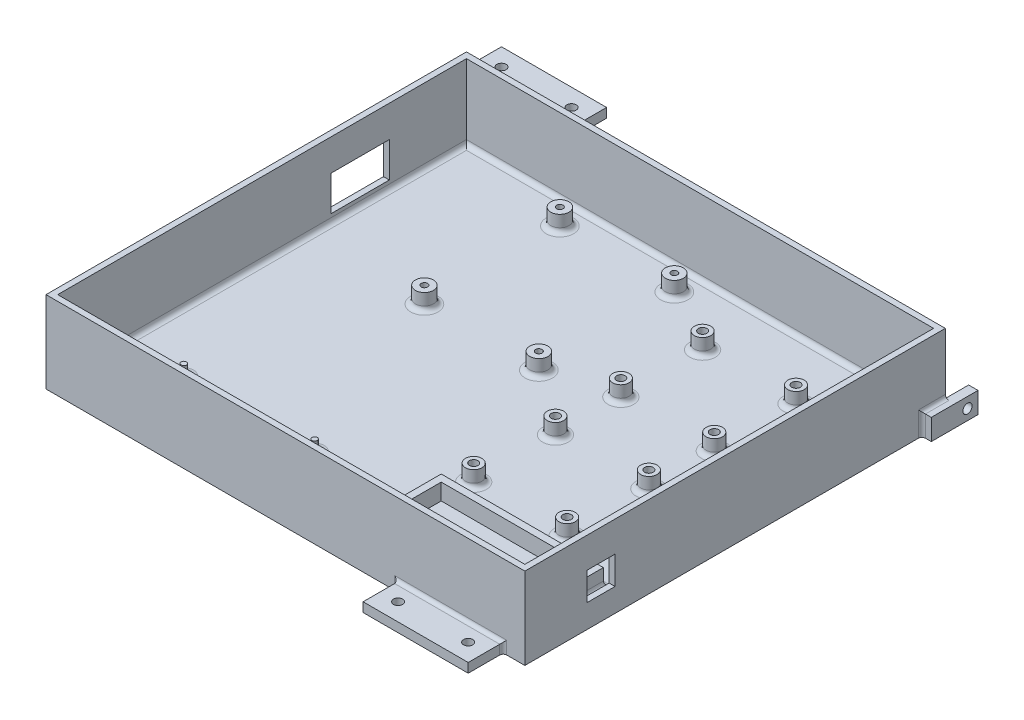
from build123d import *

# Parameters (mm, degrees)
SKETCH1_W           = 200
SKETCH1_H           = 175
BOSS_EXTRUDE1_DEPTH = 3
SKETCH2_W           = 69.4
SKETCH2_H           = 33.6
SKETCH2_W_2         = 63.4
SKETCH2_H_2         = 27.6
BOSS_EXTRUDE2_DEPTH = 7
SKETCH3_R           = 3.5
SKETCH3_R_2         = 1.818181818
BOSS_EXTRUDE3_DEPTH = 7
SKETCH4_R           = 3.863636364
SKETCH4_R_2         = 1.363636364
BOSS_EXTRUDE4_DEPTH = 7
SKETCH6_W           = 205
SKETCH6_H           = 180
SKETCH6_W_2         = 200
SKETCH6_H_2         = 175
BOSS_EXTRUDE5_DEPTH = 35
FILLET1_R           = 2
SKETCH7_W           = 12
SKETCH7_H           = 12
CUT_EXTRUDE1_DEPTH  = 225.346272534
SKETCH8_R           = 1.136363636
BOSS_EXTRUDE6_DEPTH = 4.5
FILLET2_R           = 3
SKETCH9_W           = 25
SKETCH9_H           = 15
CUT_EXTRUDE2_DEPTH  = 10
SKETCH10_W          = 20
SKETCH10_H          = 9
SKETCH10_R          = 1.98501
BOSS_EXTRUDE7_DEPTH = 4
SKETCH11_W          = 45
SKETCH11_H          = 15
SKETCH11_R          = 1.98501
BOSS_EXTRUDE8_DEPTH = 4
BOSS_EXTRUDE9_START = -25.4
SKETCH12_W          = 45
SKETCH12_H          = 15
SKETCH12_R          = 1.98501
BOSS_EXTRUDE9_DEPTH = 4
FILLET3_R           = 1.5


with BuildPart() as part:
    # Sketch1 → Boss-Extrude1 (new body)
    with BuildSketch(Plane(origin=(0, 0, 0), x_dir=(1, 0, 0), z_dir=(0, 1, 0))):
        Rectangle(SKETCH1_W, SKETCH1_H)
    extrude(amount=BOSS_EXTRUDE1_DEPTH)

    # Sketch2 → Boss-Extrude2 (add)
    with BuildSketch(Plane(origin=(0, 3, 0), x_dir=(1, 0, 0), z_dir=(0, 1, 0))):
        with Locations((58.3, -63.7)):
            Rectangle(SKETCH2_W, SKETCH2_H)
        with Locations((58.3, -63.7)):
            Rectangle(SKETCH2_W_2, SKETCH2_H_2, mode=Mode.SUBTRACT)
    extrude(amount=BOSS_EXTRUDE2_DEPTH)

    # Sketch3 → Boss-Extrude3 (add)
    # profile 1 of 8: a face of its own
    with BuildSketch(Plane(origin=(0, 3, 0), x_dir=(1, 0, 0), z_dir=(0, 1, 0))):
        with Locations(Location((26.5, -0.9, 0), (0, 0, 270))):
            Circle(SKETCH3_R)
        with Locations(Location((26.5, -0.9, 0), (0, 0, 270))):
            Circle(SKETCH3_R_2, mode=Mode.SUBTRACT)
    # profile 2 of 8: a face of its own
    with BuildSketch(Plane(origin=(0, 3, 0), x_dir=(1, 0, 0), z_dir=(0, 1, 0))):
        with Locations(Location((26.5, -35.9, 0), (0, 0, 270))):
            Circle(SKETCH3_R)
        with Locations(Location((26.5, -35.9, 0), (0, 0, 270))):
            Circle(SKETCH3_R_2, mode=Mode.SUBTRACT)
    # profile 3 of 8: a face of its own
    with BuildSketch(Plane(origin=(0, 3, 0), x_dir=(1, 0, 0), z_dir=(0, 1, 0))):
        with Locations(Location((66.5, -0.9, 0), (0, 0, 270))):
            Circle(SKETCH3_R)
        with Locations(Location((66.5, -0.9, 0), (0, 0, 270))):
            Circle(SKETCH3_R_2, mode=Mode.SUBTRACT)
    # profile 4 of 8: a face of its own
    with BuildSketch(Plane(origin=(0, 3, 0), x_dir=(1, 0, 0), z_dir=(0, 1, 0))):
        with Locations(Location((66.5, -35.9, 0), (0, 0, 270))):
            Circle(SKETCH3_R)
        with Locations(Location((66.5, -35.9, 0), (0, 0, 270))):
            Circle(SKETCH3_R_2, mode=Mode.SUBTRACT)
    # profile 5 of 8: a face of its own
    with BuildSketch(Plane(origin=(0, 3, 0), x_dir=(1, 0, 0), z_dir=(0, 1, 0))):
        with Locations(Location((66.5, 27.1, 0), (0, 0, 90))):
            Circle(SKETCH3_R)
        with Locations(Location((66.5, 27.1, 0), (0, 0, 90))):
            Circle(SKETCH3_R_2, mode=Mode.SUBTRACT)
    # profile 6 of 8: a face of its own
    with BuildSketch(Plane(origin=(0, 3, 0), x_dir=(1, 0, 0), z_dir=(0, 1, 0))):
        with Locations(Location((66.5, 62.1, 0), (0, 0, 90))):
            Circle(SKETCH3_R)
        with Locations(Location((66.5, 62.1, 0), (0, 0, 90))):
            Circle(SKETCH3_R_2, mode=Mode.SUBTRACT)
    # profile 7 of 8: a face of its own
    with BuildSketch(Plane(origin=(0, 3, 0), x_dir=(1, 0, 0), z_dir=(0, 1, 0))):
        with Locations(Location((26.5, 62.1, 0), (0, 0, 90))):
            Circle(SKETCH3_R)
        with Locations(Location((26.5, 62.1, 0), (0, 0, 90))):
            Circle(SKETCH3_R_2, mode=Mode.SUBTRACT)
    # profile 8 of 8: a face of its own
    with BuildSketch(Plane(origin=(0, 3, 0), x_dir=(1, 0, 0), z_dir=(0, 1, 0))):
        with Locations(Location((26.5, 27.1, 0), (0, 0, 90))):
            Circle(SKETCH3_R)
        with Locations(Location((26.5, 27.1, 0), (0, 0, 90))):
            Circle(SKETCH3_R_2, mode=Mode.SUBTRACT)
    extrude(amount=BOSS_EXTRUDE3_DEPTH)

    # Sketch4 → Boss-Extrude4 (add)
    # profile 1 of 4: a face of its own
    with BuildSketch(Plane(origin=(0, 3, 0), x_dir=(1, 0, 0), z_dir=(0, 1, 0))):
        with Locations(Location((-50, 77.5, 0), (0, 0, 270))):
            Circle(SKETCH4_R)
        with Locations(Location((-50, 77.5, 0), (0, 0, 270))):
            Circle(SKETCH4_R_2, mode=Mode.SUBTRACT)
    # profile 2 of 4: a face of its own
    with BuildSketch(Plane(origin=(0, 3, 0), x_dir=(1, 0, 0), z_dir=(0, 1, 0))):
        with Locations(Location((-1, 77.5, 0), (0, 0, 270))):
            Circle(SKETCH4_R)
        with Locations(Location((-1, 77.5, 0), (0, 0, 270))):
            Circle(SKETCH4_R_2, mode=Mode.SUBTRACT)
    # profile 3 of 4: a face of its own
    with BuildSketch(Plane(origin=(0, 3, 0), x_dir=(1, 0, 0), z_dir=(0, 1, 0))):
        with Locations(Location((-1, 19.5, 0), (0, 0, 270))):
            Circle(SKETCH4_R)
        with Locations(Location((-1, 19.5, 0), (0, 0, 270))):
            Circle(SKETCH4_R_2, mode=Mode.SUBTRACT)
    # profile 4 of 4: a face of its own
    with BuildSketch(Plane(origin=(0, 3, 0), x_dir=(1, 0, 0), z_dir=(0, 1, 0))):
        with Locations(Location((-50, 19.5, 0), (0, 0, 270))):
            Circle(SKETCH4_R)
        with Locations(Location((-50, 19.5, 0), (0, 0, 270))):
            Circle(SKETCH4_R_2, mode=Mode.SUBTRACT)
    extrude(amount=BOSS_EXTRUDE4_DEPTH)

    # Sketch6 → Boss-Extrude5 (add)
    with BuildSketch(Plane.XZ):
        Rectangle(SKETCH6_W, SKETCH6_H)
        Rectangle(SKETCH6_W_2, SKETCH6_H_2, mode=Mode.SUBTRACT)
    extrude(amount=-BOSS_EXTRUDE5_DEPTH)

    # Fillet1
    fillet1_edges = [part.edges().sort_by_distance(p)[0] for p in [
        (-50, 3, -81.363636364),
        (-1, 3, -81.363636364),
        (-1, 3, -23.363636364),
        (-50, 3, -23.363636364),
        (100, 3, 0),
        (0, 3, -87.5),
        (58.3, 3, 46.9),
        (23.6, 3, 63.7),
        (58.3, 3, 80.5),
        (93, 3, 63.7),
        (26.5, 3, 32.4),
        (26.5, 3, -2.6),
        (-100, 3, 0),
        (66.5, 3, -2.6),
        (66.5, 3, 32.4),
        (66.5, 3, -23.6),
        (66.5, 3, -58.6),
        (26.5, 3, -58.6),
        (26.5, 3, -23.6),
        (0, 3, 87.5),
    ]]
    fillet(fillet1_edges, radius=FILLET1_R)

    # Sketch7 → Cut-Extrude1 (cut, through all)
    with BuildSketch(Plane.ZY.offset(-100)):
        with Locations((57.4, 16)):
            Rectangle(SKETCH7_W, SKETCH7_H)
    extrude(amount=-CUT_EXTRUDE1_DEPTH, mode=Mode.SUBTRACT)

    # Sketch8 → Boss-Extrude6 (add)
    with BuildSketch(Plane(origin=(0, 3, 0), x_dir=(1, 0, 0), z_dir=(0, 1, 0))):
        with Locations(Location((-19, -58.5, 0), (0, 0, 270))):
            Circle(SKETCH8_R)
        with Locations(Location((-75, -58.5, 0), (0, 0, 270))):
            Circle(SKETCH8_R)
        with Locations(Location((-75, -77.5, 0), (0, 0, 270))):
            Circle(SKETCH8_R)
        with Locations(Location((-19, -77.5, 0), (0, 0, 270))):
            Circle(SKETCH8_R)
    extrude(amount=BOSS_EXTRUDE6_DEPTH)

    # Fillet2
    fillet2_edges = [part.edges().sort_by_distance(p)[0] for p in [
        (-19, 3, 57.363636364),
        (-75, 3, 57.363636364),
        (-75, 3, 76.363636364),
        (-19, 3, 76.363636364),
    ]]
    fillet(fillet2_edges, radius=FILLET2_R)

    # Sketch9 → Cut-Extrude2 (cut)
    with BuildSketch(Plane.ZY.offset(102.5)):
        with Locations((-42, 14)):
            Rectangle(SKETCH9_W, SKETCH9_H)
    extrude(amount=-CUT_EXTRUDE2_DEPTH, mode=Mode.SUBTRACT)

    # Sketch10 → Boss-Extrude7 (add)
    with BuildSketch(Plane(origin=(102.5, 0, 0), x_dir=(0, 0, -1), z_dir=(1, 0, 0))):
        with Locations((90, 4.5)):
            Rectangle(SKETCH10_W, SKETCH10_H)
        with Locations((95.5, 4.5)):
            Circle(SKETCH10_R, mode=Mode.SUBTRACT)
    extrude(amount=BOSS_EXTRUDE7_DEPTH)

    # Sketch11 → Boss-Extrude8 (add)
    with BuildSketch(Plane.XZ):
        with Locations((70.75, 97.5)):
            Rectangle(SKETCH11_W, SKETCH11_H)
        with Locations(Location((55.75, 97.5, 0), (0, 0, 270))):
            Circle(SKETCH11_R, mode=Mode.SUBTRACT)
        with Locations(Location((85.75, 97.5, 0), (0, 0, 270))):
            Circle(SKETCH11_R, mode=Mode.SUBTRACT)
    extrude(amount=-BOSS_EXTRUDE8_DEPTH)

    # Sketch12 → Boss-Extrude9 (add)
    with BuildSketch(Plane.XZ.offset(BOSS_EXTRUDE9_START)):
        with Locations((-80, -97.5)):
            Rectangle(SKETCH12_W, SKETCH12_H)
        with Locations(Location((-95, -97.5, 0), (0, 0, 270))):
            Circle(SKETCH12_R, mode=Mode.SUBTRACT)
        with Locations(Location((-65, -97.5, 0), (0, 0, 270))):
            Circle(SKETCH12_R, mode=Mode.SUBTRACT)
    extrude(amount=-BOSS_EXTRUDE9_DEPTH)

    # Fillet3
    fillet3_edges = [part.edges().sort_by_distance(p)[0] for p in [
        (102.5, 9, -85),
        (102.5, 4.5, -80),
        (48.25, 2, 90),
        (70.75, 4, 90),
        (93.25, 2, 90),
        (-80, 29.4, -90),
        (-57.5, 27.4, -90),
    ]]
    fillet(fillet3_edges, radius=FILLET3_R)


solid = part.part
